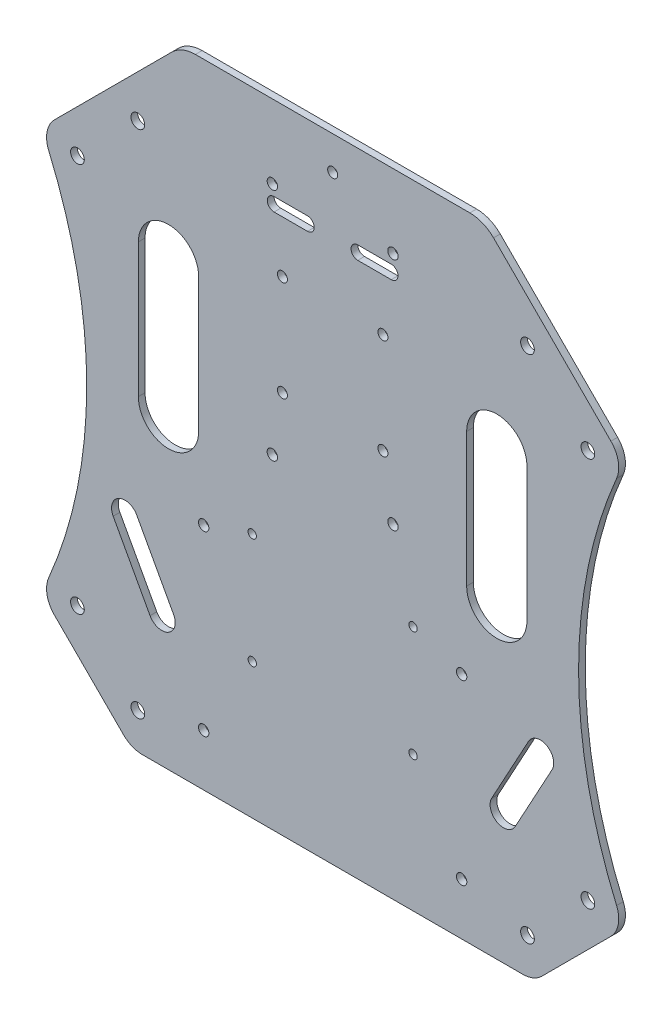
from build123d import *

# Parameters (mm, degrees)
SKETCH1_R           = 1.5
SKETCH1_R_2         = 1.25
SKETCH1_R_3         = 2.05
BOSS_EXTRUDE1_DEPTH = 2
FILLET7_R           = 8
BOSS_EXTRUDE2_DEPTH = 2
FILLET8_R           = 10
SKETCH4_R           = 1.55
CUT_EXTRUDE1_DEPTH  = 2
SKETCH5_R           = 1.55
CUT_EXTRUDE2_DEPTH  = 2
CUT_EXTRUDE3_DEPTH  = 10
SKETCH7_R           = 1.5
CUT_EXTRUDE4_DEPTH  = 10


with BuildPart() as part:
    # Sketch1 → Boss-Extrude1 (new body)
    with BuildSketch(Plane.XY):
        with BuildLine():
            Line((-86.974134086, 60.104076401), (-60.104076401, 86.974134086))
            Line((-60.104076401, 86.974134086), (60.104076401, 86.974134086))
            Line((60.104076401, 86.974134086), (86.974134086, 60.104076401))
            ThreePointArc((86.974134086, 60.104076401), (73.41582025, 0), (86.974134086, -60.104076401))
            Line((86.974134086, -60.104076401), (60.104076401, -86.974134086))
            Line((60.104076401, -86.974134086), (-60.104076401, -86.974134086))
            Line((-60.104076401, -86.974134086), (-86.974134086, -60.104076401))
            ThreePointArc((-86.974134086, -60.104076401), (-73.41582025, 0), (-86.974134086, 60.104076401))
        make_face()
        with Locations((-15, 57.5)):
            Circle(SKETCH1_R, mode=Mode.SUBTRACT)
        with Locations((-15, 27.5)):
            Circle(SKETCH1_R, mode=Mode.SUBTRACT)
        with Locations((15, 27.5)):
            Circle(SKETCH1_R, mode=Mode.SUBTRACT)
        with Locations((15, 57.5)):
            Circle(SKETCH1_R, mode=Mode.SUBTRACT)
        with Locations((-24, -13.5)):
            Circle(SKETCH1_R_2, mode=Mode.SUBTRACT)
        with Locations((24, -13.5)):
            Circle(SKETCH1_R_2, mode=Mode.SUBTRACT)
        with Locations((24, -46.5)):
            Circle(SKETCH1_R_2, mode=Mode.SUBTRACT)
        with Locations((-24, -46.5)):
            Circle(SKETCH1_R_2, mode=Mode.SUBTRACT)
        with Locations((-76.190755673, 58.159532753)):
            Circle(SKETCH1_R_3, mode=Mode.SUBTRACT)
        with Locations((-58.159532753, 76.190755673)):
            Circle(SKETCH1_R_3, mode=Mode.SUBTRACT)
        with Locations((76.190755673, -58.159532753)):
            Circle(SKETCH1_R_3, mode=Mode.SUBTRACT)
        with Locations((58.159532753, -76.190755673)):
            Circle(SKETCH1_R_3, mode=Mode.SUBTRACT)
        with Locations((-58.159532753, -76.190755673)):
            Circle(SKETCH1_R_3, mode=Mode.SUBTRACT)
        with Locations((-76.190755673, -58.159532753)):
            Circle(SKETCH1_R_3, mode=Mode.SUBTRACT)
        with Locations((58.159532753, 76.190755673)):
            Circle(SKETCH1_R_3, mode=Mode.SUBTRACT)
        with Locations((76.190755673, 58.159532753)):
            Circle(SKETCH1_R_3, mode=Mode.SUBTRACT)
    extrude(amount=BOSS_EXTRUDE1_DEPTH)

    # Fillet7
    fillet7_edges = [part.edges().sort_by_distance(p)[0] for p in [
        (86.974134086, -60.104076401, 1),
        (60.104076401, -86.974134086, 1),
        (-60.104076401, -86.974134086, 1),
        (-86.974134086, -60.104076401, 1),
        (-86.974134086, 60.104076401, 1),
        (-60.104076401, 86.974134086, 1),
        (60.104076401, 86.974134086, 1),
        (86.974134086, 60.104076401, 1),
    ]]
    fillet(fillet7_edges, radius=FILLET7_R)

    # Sketch2 → Boss-Extrude2 (add)
    with BuildSketch(Plane.XY.offset(2)):
        with BuildLine():
            Line((-62.447222151, 84.630988335), (-45.104076401, 101.974134086))
            Line((-45.104076401, 101.974134086), (45.104076401, 101.974134086))
            Line((45.104076401, 101.974134086), (62.447222151, 84.630988335))
            ThreePointArc((62.447222151, 84.630988335), (59.851835361, 86.365170346), (56.790367902, 86.974134086))
            Line((56.790367902, 86.974134086), (-56.790367902, 86.974134086))
            ThreePointArc((-56.790367902, 86.974134086), (-59.851835361, 86.365170346), (-62.447222151, 84.630988335))
        make_face()
    extrude(amount=-BOSS_EXTRUDE2_DEPTH)

    # Fillet8
    fillet8_edges = [part.edges().sort_by_distance(p)[0] for p in [
        (-45.104076401, 101.974134086, 1),
        (45.104076401, 101.974134086, 1),
    ]]
    fillet(fillet8_edges, radius=FILLET8_R)

    # Sketch4 → Cut-Extrude1 (cut)
    with BuildSketch(Plane.XY.offset(2)):
        with Locations((-38.5, -18.5)):
            Circle(SKETCH4_R)
        with Locations((38.5, -18.5)):
            Circle(SKETCH4_R)
        with Locations((38.5, -71.5)):
            Circle(SKETCH4_R)
        with Locations((-38.5, -71.5)):
            Circle(SKETCH4_R)
    extrude(amount=-CUT_EXTRUDE1_DEPTH, mode=Mode.SUBTRACT)

    # Sketch5 → Cut-Extrude2 (cut)
    with BuildSketch(Plane.XY.offset(2)):
        with Locations((-18, 80)):
            Circle(SKETCH5_R)
        with Locations((18, 80)):
            Circle(SKETCH5_R)
        with Locations((18, 10)):
            Circle(SKETCH5_R)
        with Locations((-18, 10)):
            Circle(SKETCH5_R)
    extrude(amount=-CUT_EXTRUDE2_DEPTH, mode=Mode.SUBTRACT)

    # Sketch6 → Cut-Extrude3 (cut)
    with BuildSketch(Plane.XY.offset(2)):
        with BuildLine():
            Line((-40, 45), (-40, 5))
            ThreePointArc((-40, 5), (-49, -4), (-58, 5))
            Line((-58, 5), (-58, 45))
            ThreePointArc((-58, 45), (-49, 54), (-40, 45))
        make_face()
        with BuildLine():
            Line((40, 45), (40, 5))
            ThreePointArc((40, 5), (49, -4), (58, 5))
            Line((58, 5), (58, 45))
            ThreePointArc((58, 45), (49, 54), (40, 45))
        make_face()
        with BuildLine():
            Line((-58.487128717, -25.862080731), (-47.487128717, -46.061090608))
            ThreePointArc((-47.487128717, -46.061090608), (-49.086956522, -51.487005369), (-54.512871283, -49.887177564))
            Line((-54.512871283, -49.887177564), (-65.512871283, -29.688167687))
            ThreePointArc((-65.512871283, -29.688167687), (-63.913043478, -24.262252926), (-58.487128717, -25.862080731))
        make_face()
        with BuildLine():
            Line((58.487128717, -25.862080731), (47.487128717, -46.061090608))
            ThreePointArc((47.487128717, -46.061090608), (49.086956522, -51.487005369), (54.512871283, -49.887177564))
            Line((54.512871283, -49.887177564), (65.512871283, -29.688167687))
            ThreePointArc((65.512871283, -29.688167687), (63.913043478, -24.262252926), (58.487128717, -25.862080731))
        make_face()
    extrude(amount=-CUT_EXTRUDE3_DEPTH, mode=Mode.SUBTRACT)

    # Sketch7 → Cut-Extrude4 (cut)
    with BuildSketch(Plane.XY.offset(2)):
        with Locations((0, 91.974134086)):
            Circle(SKETCH7_R)
        with BuildLine():
            Line((-17.5, 76.974134086), (-7.5, 76.974134086))
            ThreePointArc((-7.5, 76.974134086), (-5.5, 74.974134086), (-7.5, 72.974134086))
            Line((-7.5, 72.974134086), (-17.5, 72.974134086))
            ThreePointArc((-17.5, 72.974134086), (-19.5, 74.974134086), (-17.5, 76.974134086))
        make_face()
        with BuildLine():
            Line((7.5, 76.974134086), (17.5, 76.974134086))
            ThreePointArc((17.5, 76.974134086), (19.5, 74.974134086), (17.5, 72.974134086))
            Line((17.5, 72.974134086), (7.5, 72.974134086))
            ThreePointArc((7.5, 72.974134086), (5.5, 74.974134086), (7.5, 76.974134086))
        make_face()
    extrude(amount=-CUT_EXTRUDE4_DEPTH, mode=Mode.SUBTRACT)


solid = part.part
